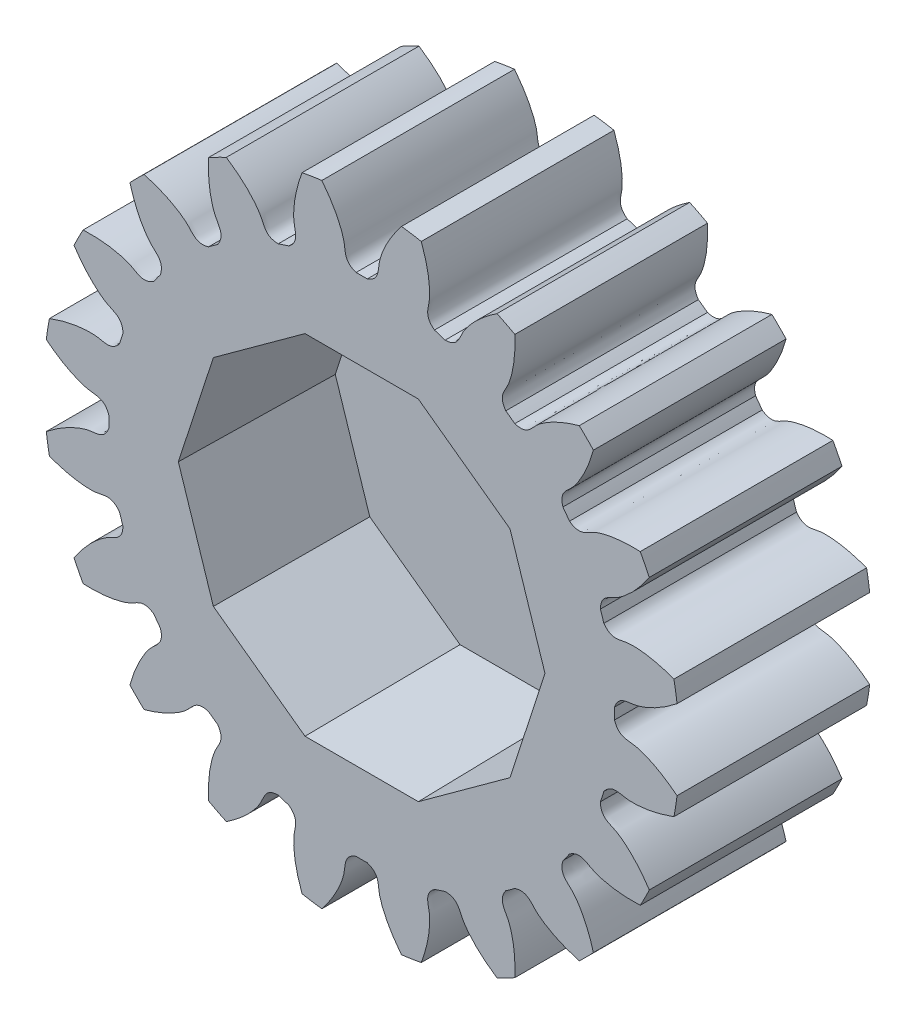
from build123d import *

# Parameters (mm, degrees)
SKETCH_1_R               = 16.5
EXTRUDE_1_DEPTH          = 10
CUT_EXTRUDE_1_DEPTH      = 26.38700455
PATTERN_CIRCULAR_1_COUNT = 20
CUT_EXTRUDE_2_DEPTH      = 8
CUT_EXTRUDE_2_DRAFT      = -1


with BuildPart() as part:
    # 草图1 → 凸台-拉伸1 (new body)
    with BuildSketch(Plane.XY):
        Circle(SKETCH_1_R)
    extrude(amount=EXTRUDE_1_DEPTH)

    # 草图2 → 切除-拉伸1 (cut, through all)
    with BuildSketch(Plane.XY):
        with BuildLine():
            ThreePointArc((0.289974901, 13.121796354), (0, 13.125), (-0.289974901, 13.121796354))
            add(Edge.make_bspline(
                [(-0.289974901, 13.121796354), (-0.916784107, 13.340213268), (-0.835626149, 13.780670548), (-0.919345585, 14.205014104), (-0.928338279, 14.246334921), (-0.939466335, 14.292951923), (-0.952938145, 14.344795254), (-0.96896871, 14.401787245), (-0.987768083, 14.463844242), (-1.009544807, 14.5308761), (-1.034504625, 14.602786421), (-1.06285065, 14.679472568), (-1.094783098, 14.760825751), (-1.130499153, 14.846731096), (-1.170192797, 14.937067727), (-1.214054647, 15.031708847), (-1.2622718, 15.130521826), (-1.315027675, 15.233368292), (-1.372501858, 15.340104225), (-1.434869948, 15.450580056), (-1.502303414, 15.564640771), (-1.574969439, 15.682126017), (-1.653030782, 15.802870208), (-1.736645634, 15.926702646), (-1.825967477, 16.05344763), (-1.921144951, 16.182924586), (-2.022321721, 16.314948181), (-2.129636342, 16.449328459), (-2.24322214, 16.585870967), (-2.363207078, 16.724376892), (-2.489713645, 16.864643194), (-2.622858733, 17.006462752), (-2.762753527, 17.149624504), (-2.909503389, 17.29391359), (-3.06320776, 17.439111509), (-3.223960048, 17.584996263), (-3.391847534, 17.731342516), (-3.566951278, 17.877921749), (-3.749346018, 18.024502419), (-3.939100102, 18.170850122), (-4.136275349, 18.31672776), (-4.412210386, 18.512459802), (-4.625898619, 18.654498902), (-4.771736973, 18.747377789)],
                knots=[0, 0, 0, 0, 0.165916003, 0.170905922, 0.176663519, 0.183188797, 0.190481754, 0.198542391, 0.207370708, 0.216966704, 0.22733038, 0.238461736, 0.250360771, 0.263027487, 0.276461881, 0.290663956, 0.30563371, 0.321371144, 0.337876258, 0.355149051, 0.373189524, 0.391997677, 0.411573509, 0.431917021, 0.453028213, 0.474907084, 0.497553636, 0.520967867, 0.545149777, 0.570099367, 0.595816637, 0.622301587, 0.649554216, 0.677574526, 0.706362514, 0.735918183, 0.766241531, 0.797332559, 0.829191267, 0.861817654, 0.895211721, 0.929373468, 1, 1, 1, 1], degree=3))
            ThreePointArc((-4.771736973, 18.747377789), (0, 19.345119481), (4.771736973, 18.747377789))
            add(Edge.make_bspline(
                [(0.289974901, 13.121796354), (0.916784107, 13.340213268), (0.835626149, 13.780670548), (0.919345585, 14.205014104), (0.928338279, 14.246334921), (0.939466335, 14.292951923), (0.952938145, 14.344795254), (0.96896871, 14.401787245), (0.987768083, 14.463844242), (1.009544807, 14.5308761), (1.034504625, 14.602786421), (1.06285065, 14.679472568), (1.094783098, 14.760825751), (1.130499153, 14.846731096), (1.170192797, 14.937067727), (1.214054647, 15.031708847), (1.2622718, 15.130521826), (1.315027675, 15.233368292), (1.372501858, 15.340104225), (1.434869948, 15.450580056), (1.502303414, 15.564640771), (1.574969439, 15.682126017), (1.653030782, 15.802870208), (1.736645634, 15.926702646), (1.825967477, 16.05344763), (1.921144951, 16.182924586), (2.022321721, 16.314948181), (2.129636342, 16.449328459), (2.24322214, 16.585870967), (2.363207078, 16.724376892), (2.489713645, 16.864643194), (2.622858733, 17.006462752), (2.762753527, 17.149624504), (2.909503389, 17.29391359), (3.06320776, 17.439111509), (3.223960048, 17.584996263), (3.391847534, 17.731342516), (3.566951278, 17.877921749), (3.749346018, 18.024502419), (3.939100102, 18.170850122), (4.136275349, 18.31672776), (4.412210386, 18.512459802), (4.625898619, 18.654498902), (4.771736973, 18.747377789)],
                knots=[0, 0, 0, 0, 0.165916003, 0.170905922, 0.176663519, 0.183188797, 0.190481754, 0.198542391, 0.207370708, 0.216966704, 0.22733038, 0.238461736, 0.250360771, 0.263027487, 0.276461881, 0.290663956, 0.30563371, 0.321371144, 0.337876258, 0.355149051, 0.373189524, 0.391997677, 0.411573509, 0.431917021, 0.453028213, 0.474907084, 0.497553636, 0.520967867, 0.545149777, 0.570099367, 0.595816637, 0.622301587, 0.649554216, 0.677574526, 0.706362514, 0.735918183, 0.766241531, 0.797332559, 0.829191267, 0.861817654, 0.895211721, 0.929373468, 1, 1, 1, 1], degree=3))
        make_face()
    cut_extrude_1 = extrude(amount=CUT_EXTRUDE_1_DEPTH, mode=Mode.SUBTRACT)

    # 阵列(圆周)1: 切除-拉伸1 ×20 about axis
    pattern_circular_1_axis = Axis((0, 0, -0.5), (0, 0, 1))
    for i in range(1, PATTERN_CIRCULAR_1_COUNT):
        add(cut_extrude_1.rotate(pattern_circular_1_axis, i * 360 / PATTERN_CIRCULAR_1_COUNT), mode=Mode.SUBTRACT)


with BuildPart() as cut_extrude_2_tool:
    # 草图4 → 切除-拉伸2 (with draft: the straight prism first)
    with BuildSketch(Plane.XY.offset(10)):
        Polygon((9.515733129, 0), (7.698389816, 5.593207598), (2.940523251, 9.05), (-2.940523251, 9.05), (-7.698389816, 5.593207598), (-9.515733129, 0), (-7.698389816, -5.593207598), (-2.940523251, -9.05), (2.940523251, -9.05), (7.698389816, -5.593207598), align=None)
    extrude(amount=-CUT_EXTRUDE_2_DEPTH)
    # 切除-拉伸2: the draft: its side faces are tilted about the plane it starts from
    cut_extrude_2_sides = [cut_extrude_2_tool.faces().sort_by_distance(p)[0] for p in [
        (8.607061472, 2.796603799, 6),
        (5.319456533, 7.321603799, 6),
        (0, 9.05, 6),
        (-5.319456533, 7.321603799, 6),
        (-8.607061472, 2.796603799, 6),
        (-8.607061472, -2.796603799, 6),
        (-5.319456533, -7.321603799, 6),
        (0, -9.05, 6),
        (5.319456533, -7.321603799, 6),
        (8.607061472, -2.796603799, 6),
    ]]
    draft(cut_extrude_2_sides, Plane.XY.offset(10), CUT_EXTRUDE_2_DRAFT)


with BuildPart() as part_1:
    add(part.part)

    # 切除-拉伸2: cut by cut_extrude_2_tool
    add(cut_extrude_2_tool.part, mode=Mode.SUBTRACT)


solid = part_1.part
